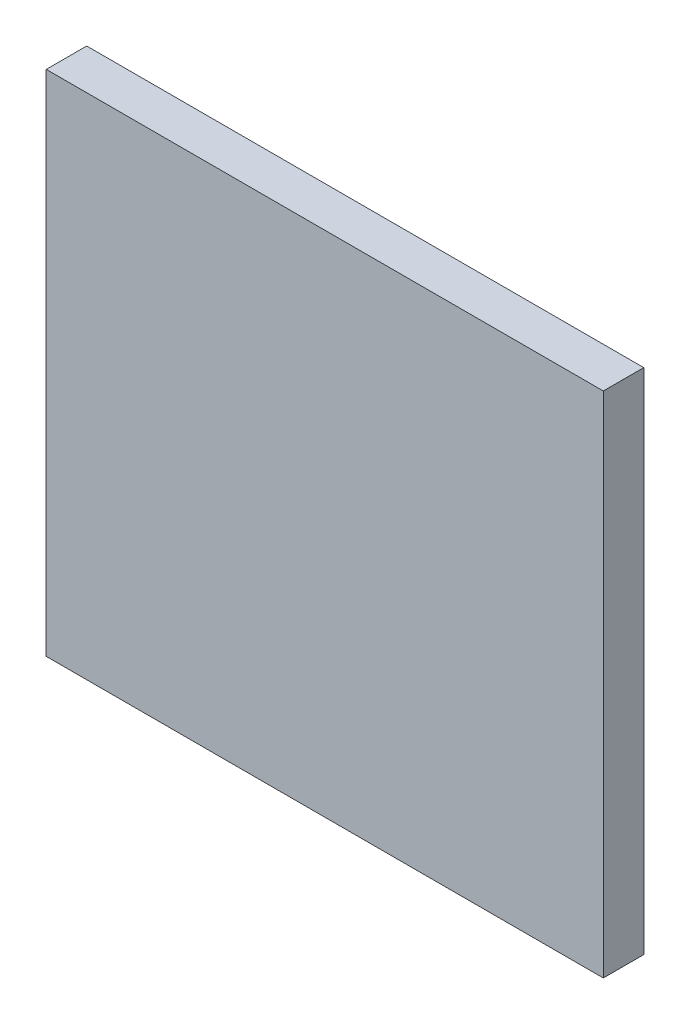
from build123d import *

# Parameters (mm, degrees)
SKETCH1_W           = 41.300127667
SKETCH1_H           = 37.691378647
BOSS_EXTRUDE1_DEPTH = 3


with BuildPart() as part:
    # Sketch1 → Boss-Extrude1 (new body)
    with BuildSketch(Plane.XY):
        with Locations((3.00729085, -3.00729085)):
            Rectangle(SKETCH1_W, SKETCH1_H)
    extrude(amount=BOSS_EXTRUDE1_DEPTH)


solid = part.part
